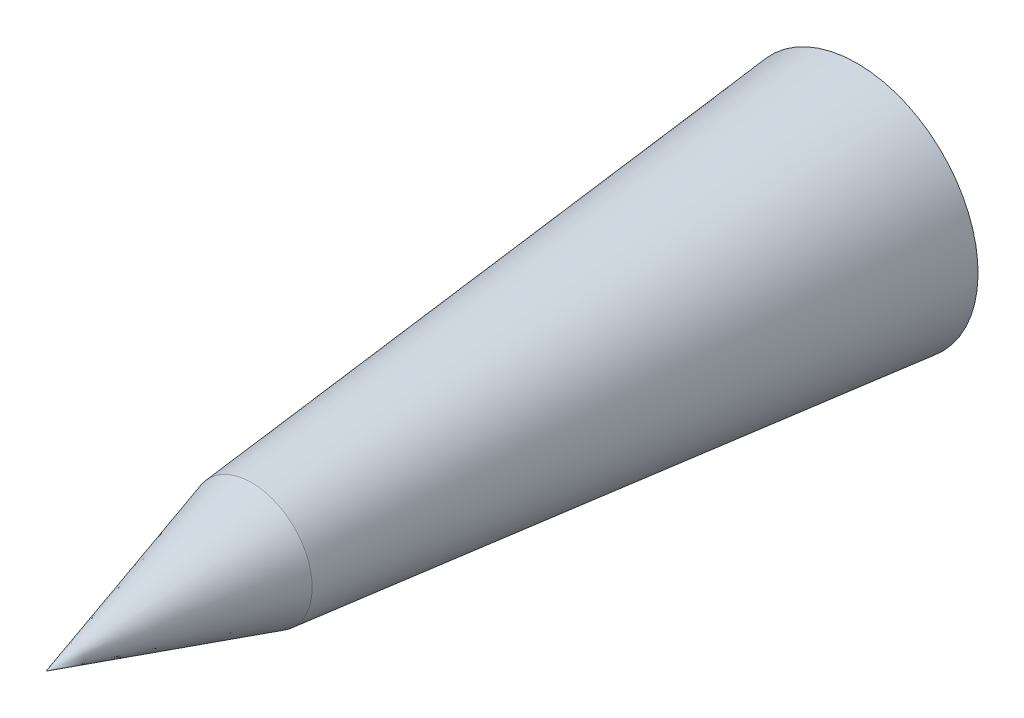
from build123d import *


with BuildPart() as part:
    # Sketch1 → Revolve1 (revolve)
    with BuildSketch(Plane(origin=(0, 0, 0), x_dir=(0, 0, -1), z_dir=(1, 0, 0))):
        Polygon((0, 50.8), (0, 0), (-340.285040562, 0), (-254, 25.4), align=None)
    revolve(axis=Axis((0, 0, 0), (0, 0, 1)))


solid = part.part
